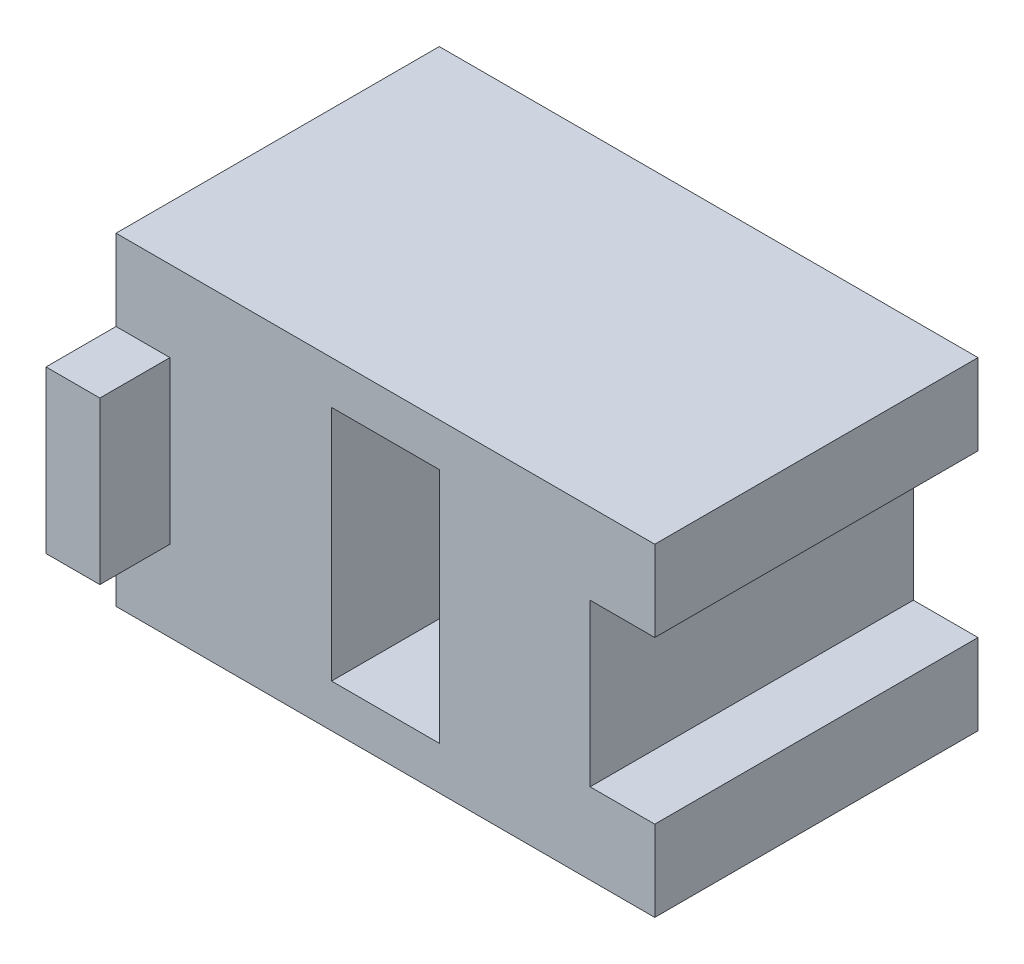
from build123d import *

# Parameters (mm, degrees)
SKETCH_1_W           = 50
SKETCH_1_H           = 30
EXTRUDE_1_DEPTH      = 30
SKETCH_2_W           = 10
SKETCH_2_H           = 22
SKETCH_2_W_2         = 6
SKETCH_2_H_2         = 15
CUT_EXTRUDE_1_DEPTH  = 42.833001327
SKETCH_3_W           = 5
SKETCH_3_H           = 15
EXTRUDE_2_DEPTH      = 6.5
EXTRUDE_3_DEPTH      = 6
EXTRUDE_3_DEPTH_BACK = 6


with BuildPart() as part:
    # Эскиз1 → Бобышка-Вытянуть1 (new body)
    with BuildSketch(Plane.XY):
        Rectangle(SKETCH_1_W, SKETCH_1_H)
    extrude(amount=EXTRUDE_1_DEPTH)

    # Эскиз2 → Вырез-Вытянуть1 (cut, through all)
    with BuildSketch(Plane.XY.offset(30)):
        Rectangle(SKETCH_2_W, SKETCH_2_H)
        with Locations((22, 0)):
            Rectangle(SKETCH_2_W_2, SKETCH_2_H_2)
    extrude(amount=-CUT_EXTRUDE_1_DEPTH, mode=Mode.SUBTRACT)

    # Эскиз3 → Бобышка-Вытянуть2 (add)
    with BuildSketch(Plane.XY.offset(30)):
        with Locations((-22.5, 0)):
            Rectangle(SKETCH_3_W, SKETCH_3_H)
    extrude(amount=EXTRUDE_2_DEPTH)

    # Эскиз4 → Бобышка-Вытянуть3 (add, two sides: drawn at the far end of the back side and taken through both)
    with BuildSketch(Plane(origin=(0, 0, 0), x_dir=(1, 0, 0), z_dir=(0, 1, 0)).offset(-EXTRUDE_3_DEPTH_BACK)):
        Polygon((-25, 0), (-25, 5), (-5, 0), align=None)
    extrude(amount=EXTRUDE_3_DEPTH + EXTRUDE_3_DEPTH_BACK)


solid = part.part
